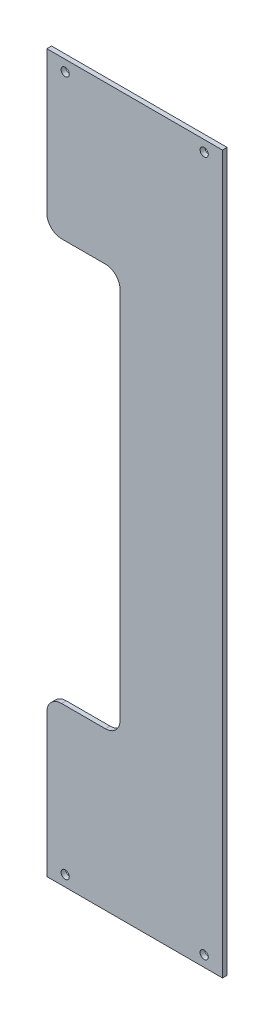
from build123d import *

# Parameters (mm, degrees)
SKETCH1_W           = 500
SKETCH1_H           = 120
SKETCH1_R           = 2.8
BOSS_EXTRUDE1_DEPTH = 3.175
SKETCH2_W           = 50
SKETCH2_H           = 275
CUT_EXTRUDE1_DEPTH  = 258.11880644
FILLET1_R           = 10
SKETCH3_W           = 120
SKETCH3_H           = 5
CUT_EXTRUDE2_DEPTH  = 258.11880644


with BuildPart() as part:
    # Sketch1 → Boss-Extrude1 (new body)
    with BuildSketch(Plane(origin=(0, 0, 0), x_dir=(0, 1, 0), z_dir=(0, 0, 1))):
        Rectangle(SKETCH1_W, SKETCH1_H)
        with Locations(Location((-237.5, 47.5, 0), (0, 0, 270))):
            Circle(SKETCH1_R, mode=Mode.SUBTRACT)
        with Locations(Location((-237.5, -47.5, 0), (0, 0, 270))):
            Circle(SKETCH1_R, mode=Mode.SUBTRACT)
        with Locations(Location((237.5, 47.5, 0), (0, 0, 270))):
            Circle(SKETCH1_R, mode=Mode.SUBTRACT)
        with Locations(Location((237.5, -47.5, 0), (0, 0, 270))):
            Circle(SKETCH1_R, mode=Mode.SUBTRACT)
    extrude(amount=BOSS_EXTRUDE1_DEPTH)

    # Sketch2 → Cut-Extrude1 (cut, through all)
    with BuildSketch(Plane.XY.offset(3.175)):
        with Locations((-35, 0)):
            Rectangle(SKETCH2_W, SKETCH2_H)
    extrude(amount=-CUT_EXTRUDE1_DEPTH, mode=Mode.SUBTRACT)

    # Fillet1
    fillet1_edges = [part.edges().sort_by_distance(p)[0] for p in [
        (-60, -137.5, 1.5875),
        (-60, 137.5, 1.5875),
        (-10, 137.5, 1.5875),
        (-10, -137.5, 1.5875),
    ]]
    fillet(fillet1_edges, radius=FILLET1_R)

    # Sketch3 → Cut-Extrude2 (cut, through all)
    with BuildSketch(Plane.XY.offset(3.175)):
        with Locations((0, 247.5)):
            Rectangle(SKETCH3_W, SKETCH3_H)
        with Locations((0, -247.5)):
            Rectangle(SKETCH3_W, SKETCH3_H)
    extrude(amount=-CUT_EXTRUDE2_DEPTH, mode=Mode.SUBTRACT)


solid = part.part
